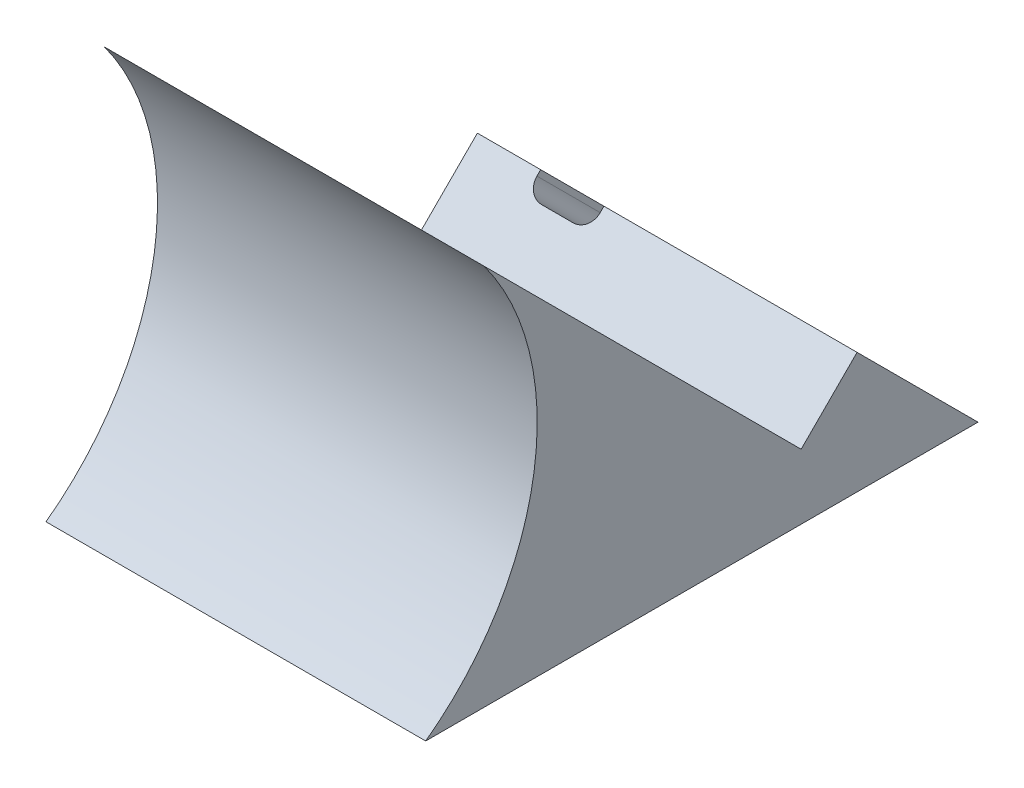
from build123d import *

# Parameters (mm, degrees)
BOSS_EXTRUDE2_DEPTH = 72
SKETCH3_W           = 12
SKETCH3_H           = 40
CUT_EXTRUDE1_DEPTH  = 4
CUT_EXTRUDE2_DEPTH  = 116.296301893
SKETCH5_W           = 12
SKETCH5_H           = 13.444323502
CUT_EXTRUDE3_DEPTH  = 4
CHAMFER1_SIZE       = 3.2
FILLET1_R           = 3


with BuildPart() as part:
    # Sketch2 → Boss-Extrude2 (new body)
    with BuildSketch(Plane(origin=(0, 0, 0), x_dir=(0, 0, -1), z_dir=(1, 0, 0))):
        with BuildLine():
            Line((10.606601718, 40.606601718), (0, 30))
            Line((0, 30), (-42.426406871, 72.426406871))
            ThreePointArc((-42.426406871, 72.426406871), (-32.969757857, 33.917072276), (-53.513108843, 0))
            Line((-53.513108843, 0), (0, 0))
            Line((0, 0), (30, 0))
            Line((30, 0), (51.213203436, 0))
            Line((51.213203436, 0), (10.606601718, 40.606601718))
        make_face()
    extrude(amount=BOSS_EXTRUDE2_DEPTH)

    # Sketch3 → Cut-Extrude1 (cut)
    with BuildSketch(Plane(origin=(0, 25.606601718, -25.606601718), x_dir=(1, 0, 0), z_dir=(0, 0.7071067811865561, -0.7071067811865389))):
        with Locations((18, -1.213203436)):
            Rectangle(SKETCH3_W, SKETCH3_H)
    extrude(amount=-CUT_EXTRUDE1_DEPTH, mode=Mode.SUBTRACT)

    # Sketch4 → Cut-Extrude2 (cut, through all)
    with BuildSketch(Plane(origin=(72, 0, 0), x_dir=(0, 0, -1), z_dir=(1, 0, 0))):
        Polygon((0, 30), (17.67766953, 12.32233047), (28.284271247, 22.928932188), (10.606601718, 40.606601718), align=None)
    extrude(amount=-CUT_EXTRUDE2_DEPTH, mode=Mode.SUBTRACT)

    # Sketch5 → Cut-Extrude3 (cut)
    with BuildSketch(Plane(origin=(0, 25.606601718, -25.606601718), x_dir=(1, 0, 0), z_dir=(0, 0.7071067811865561, -0.7071067811865389))):
        with Locations((18, 25.508958315)):
            Rectangle(SKETCH5_W, SKETCH5_H)
    extrude(amount=-CUT_EXTRUDE3_DEPTH, mode=Mode.SUBTRACT)

    # Chamfer1
    chamfer1_edges = [part.edges().sort_by_distance(p)[0] for p in [
        (18, 2.815758154, -48.397445281),
    ]]
    chamfer(chamfer1_edges, length=CHAMFER1_SIZE)

    # Fillet1
    fillet1_edges = [part.edges().sort_by_distance(p)[0] for p in [
        (24, 10.050252532, -35.506096654),
        (12, 10.050252532, -35.506096654),
    ]]
    fillet(fillet1_edges, radius=FILLET1_R)


solid = part.part
